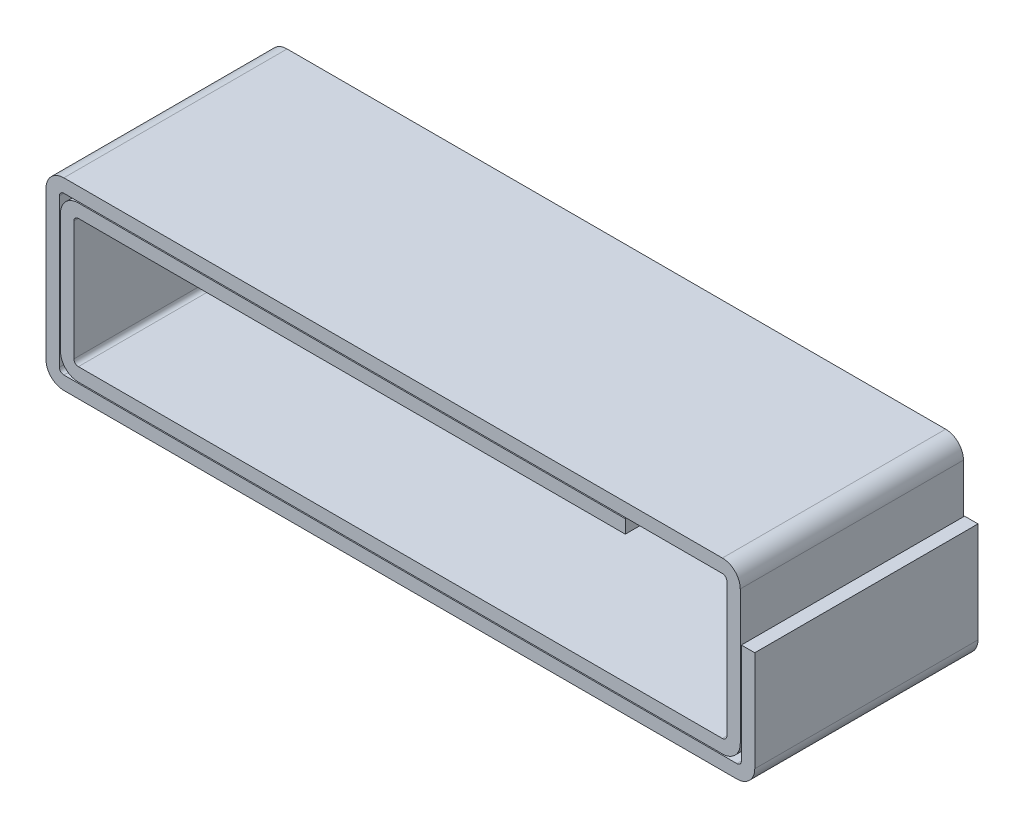
from build123d import *

# Parameters (mm, degrees)
BOSS_EXTRUDE2_DEPTH = 10


with BuildPart() as part:
    # Sketch1 → Boss-Extrude2 (new, symmetric)
    with BuildSketch(Plane.XY):
        with BuildLine():
            Line((-28.85, 13.3), (20.15, 13.3))
            Line((20.15, 13.3), (20.15, 12.1))
            Line((20.15, 12.1), (-28.85, 12.1))
            ThreePointArc((-28.85, 12.1), (-29.132842712, 11.982842712), (-29.25, 11.7))
            Line((-29.25, 11.7), (-29.25, 1))
            ThreePointArc((-29.25, 1), (-29.132842712, 0.717157288), (-28.85, 0.6))
            Line((-28.85, 0.6), (28.85, 0.6))
            ThreePointArc((28.85, 0.6), (29.132842712, 0.717157288), (29.25, 1))
            Line((29.25, 1), (29.25, 13))
            ThreePointArc((29.25, 13), (29.132842712, 13.282842712), (28.85, 13.4))
            Line((28.85, 13.4), (-30.15, 13.4))
            ThreePointArc((-30.15, 13.4), (-30.432842712, 13.282842712), (-30.55, 13))
            Line((-30.55, 13), (-30.55, -0.3))
            ThreePointArc((-30.55, -0.3), (-30.432842712, -0.582842712), (-30.15, -0.7))
            Line((-30.15, -0.7), (30.15, -0.7))
            ThreePointArc((30.15, -0.7), (30.432842712, -0.582842712), (30.55, -0.3))
            Line((30.55, -0.3), (30.55, 8.7))
            Line((30.55, 8.7), (31.75, 8.7))
            Line((31.75, 8.7), (31.75, -0.3))
            ThreePointArc((31.75, -0.3), (31.28137085, -1.43137085), (30.15, -1.9))
            Line((30.15, -1.9), (-30.15, -1.9))
            ThreePointArc((-30.15, -1.9), (-31.28137085, -1.43137085), (-31.75, -0.3))
            Line((-31.75, -0.3), (-31.75, 13))
            ThreePointArc((-31.75, 13), (-31.28137085, 14.13137085), (-30.15, 14.6))
            Line((-30.15, 14.6), (28.85, 14.6))
            ThreePointArc((28.85, 14.6), (29.98137085, 14.13137085), (30.45, 13))
            Line((30.45, 13), (30.45, 1))
            ThreePointArc((30.45, 1), (29.98137085, -0.13137085), (28.85, -0.6))
            Line((28.85, -0.6), (-28.85, -0.6))
            ThreePointArc((-28.85, -0.6), (-29.98137085, -0.13137085), (-30.45, 1))
            Line((-30.45, 1), (-30.45, 11.7))
            ThreePointArc((-30.45, 11.7), (-29.98137085, 12.83137085), (-28.85, 13.3))
        make_face()
    extrude(amount=BOSS_EXTRUDE2_DEPTH, both=True)


solid = part.part
